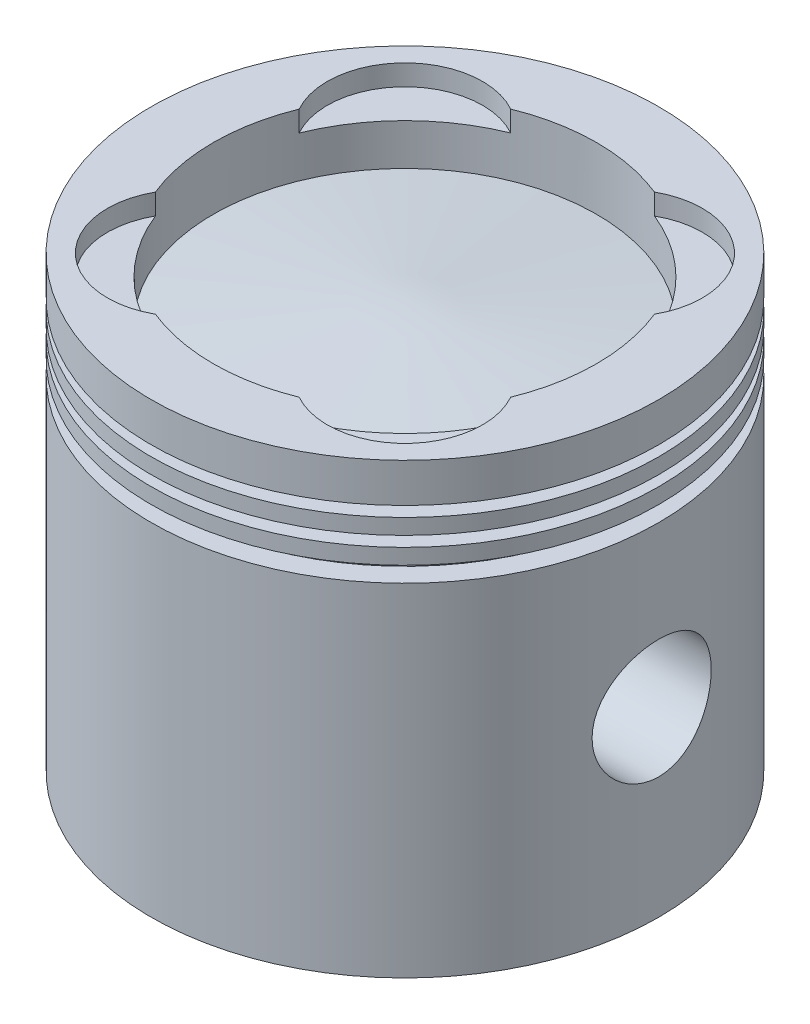
from build123d import *

# Parameters (mm, degrees)
SKETCH10_R         = 11.5
CUT_EXTRUDE1_DEPTH = 70
SKETCH12_R         = 15
CUT_EXTRUDE2_DEPTH = 4
CIRPATTERN1_COUNT  = 4


with BuildPart() as part:
    # Sketch1 → Revolve1 (revolve)
    with BuildSketch(Plane.XY):
        Polygon((37, 43.55415604), (48.996866339, 43.55415604), (48.996866339, 36), (45, 36), (45, 34), (49, 34), (49, 31), (45, 31), (45, 29), (49, 29), (49, 26), (45, 26), (45, 23), (49, 23), (49, -43), (42, -43), (42, -40), (45, -40), (45, -29.408174518), (20, -25), (20, 9), (39, 12.350212633), (39, 20), (0, 20), (0, 35.55415604), (37, 31.55415604), align=None)
    revolve(axis=Axis((0, 43, 0), (0, 1, 0)))

    # Sketch10 → Cut-Extrude1 (cut, symmetric)
    with BuildSketch(Plane(origin=(0, 0, 0), x_dir=(0, 0, -1), z_dir=(1, 0, 0))):
        with Locations((0, -8)):
            Circle(SKETCH10_R)
    extrude(amount=CUT_EXTRUDE1_DEPTH, both=True, mode=Mode.SUBTRACT)

    # Sketch12 → Cut-Extrude2 (cut)
    with BuildSketch(Plane(origin=(0, 43.55415604, 0), x_dir=(1, 0, 0), z_dir=(0, 1, 0))):
        with Locations((-21.213203436, 21.213203436)):
            Circle(SKETCH12_R)
    cut_extrude2 = extrude(amount=-CUT_EXTRUDE2_DEPTH, mode=Mode.SUBTRACT)

    # CirPattern1: Cut-Extrude2 ×4 about axis
    cirpattern1_axis = Axis((0, 0, 0), (0, 1, 0))
    for i in range(1, CIRPATTERN1_COUNT):
        add(cut_extrude2.rotate(cirpattern1_axis, i * 360 / CIRPATTERN1_COUNT), mode=Mode.SUBTRACT)


solid = part.part
